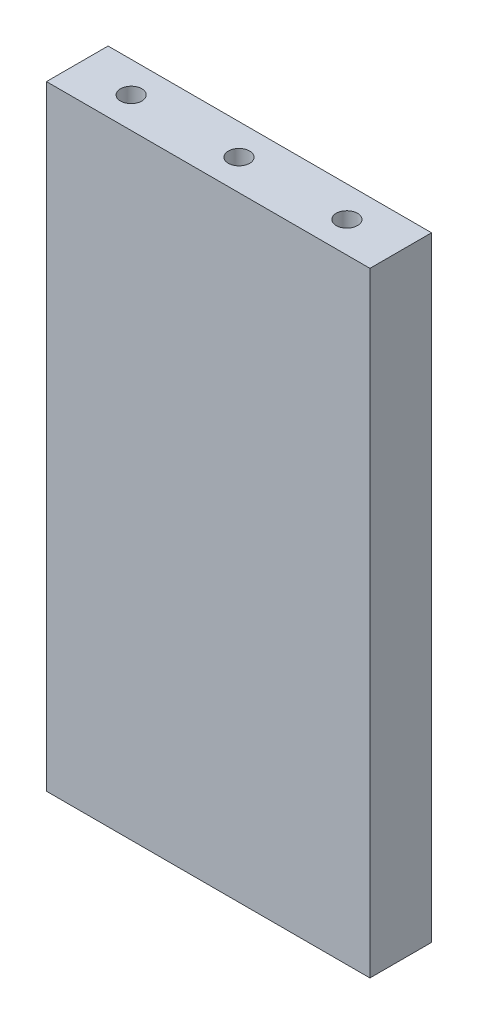
from build123d import *

# Parameters (mm, degrees)
SKETCH1_W                       = 50
SKETCH1_H                       = 95
BOSS_EXTRUDE1_DEPTH             = 9.525
TAP_DRILL_FOR_M4X0_7_TAP1_D     = 3.3
TAP_DRILL_FOR_M4X0_7_TAP1_DEPTH = 3.2
TAP_DRILL_FOR_M4X0_7_TAP1_TIP   = 0.991420021
TAP_DRILL_FOR_M4X0_7_TAP2_D     = 3.3
TAP_DRILL_FOR_M4X0_7_TAP2_DEPTH = 3.2
TAP_DRILL_FOR_M4X0_7_TAP2_TIP   = 0.991420021


with BuildPart() as part:
    # Sketch1 → Boss-Extrude1 (new body)
    with BuildSketch(Plane.XY):
        Rectangle(SKETCH1_W, SKETCH1_H)
    extrude(amount=-BOSS_EXTRUDE1_DEPTH)

    # Tap Drill for M4x0.7 Tap1
    with Locations(Plane.XZ.offset(47.5)):
        with Locations((16.67, -4.7625), (0, -4.7625), (-16.67, -4.7625)):
            Hole(TAP_DRILL_FOR_M4X0_7_TAP1_D / 2, depth=TAP_DRILL_FOR_M4X0_7_TAP1_DEPTH)
            with Locations((0, 0, -(TAP_DRILL_FOR_M4X0_7_TAP1_DEPTH + TAP_DRILL_FOR_M4X0_7_TAP1_TIP / 2))):  # 118° drill point
                Cone(0, TAP_DRILL_FOR_M4X0_7_TAP1_D / 2, TAP_DRILL_FOR_M4X0_7_TAP1_TIP, mode=Mode.SUBTRACT)

    # Tap Drill for M4x0.7 Tap2
    with Locations(Plane(origin=(0, 47.5, 0), x_dir=(1, 0, 0), z_dir=(0, 1, 0))):
        with Locations((0, 4.7625), (16.67, 4.7625), (-16.67, 4.7625)):
            Hole(TAP_DRILL_FOR_M4X0_7_TAP2_D / 2, depth=TAP_DRILL_FOR_M4X0_7_TAP2_DEPTH)
            with Locations((0, 0, -(TAP_DRILL_FOR_M4X0_7_TAP2_DEPTH + TAP_DRILL_FOR_M4X0_7_TAP2_TIP / 2))):  # 118° drill point
                Cone(0, TAP_DRILL_FOR_M4X0_7_TAP2_D / 2, TAP_DRILL_FOR_M4X0_7_TAP2_TIP, mode=Mode.SUBTRACT)


solid = part.part
